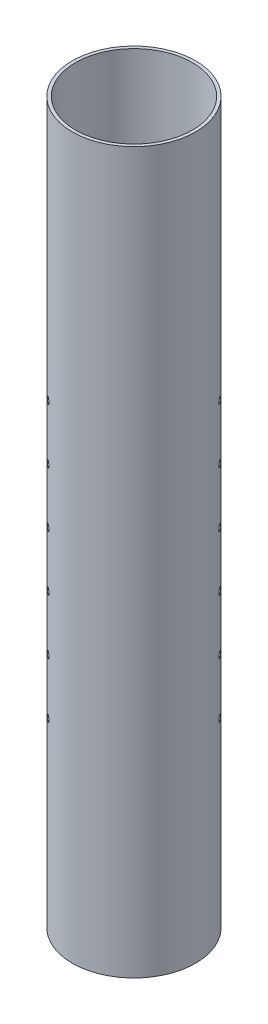
from build123d import *

# Parameters (mm, degrees)
SKETCH1_R                                     = 34.25
SKETCH1_R_2                                   = 32.5
BULK_DEPTH                                    = 400
SKETCH3_R                                     = 1.75
AVIONICS_FRONT_SCREW_HOLES_DEPTH              = 403.921983764
AVIONICS_LEFT_AND_RIGHT_SCREW_HOLES_COUNT     = 2
AVIONICS_LEFT_AND_RIGHT_SCREW_HOLES_ANGLE     = 100
AVIONICS_LEFT_AND_RIGHT_SCREW_HOLES_THE_COUNT = 2
AVIONICS_LEFT_AND_RIGHT_SCREW_HOLES_THE_ANGLE = 100
SKETCH4_W                                     = 40
SKETCH4_H                                     = 5
UMBILICAL_PASSTHRU_CUT_ANGLE                  = 20
UMBILICAL_PASSTHRU_CORNER_ROUNDING_R          = 3
RBF_CUTOUT_REACH                              = 410.251
RBF_CUTOUT_END_RADIUS                         = 32.5
SKETCH5_R                                     = 5


with BuildPart() as part:
    # Sketch1 → BULK (new body)
    with BuildSketch(Plane(origin=(0, 0, 0), x_dir=(1, 0, 0), z_dir=(0, 1, 0))):
        with Locations(Location((0, 0, 0), (0, 0, 270))):
            Circle(SKETCH1_R)
        with Locations(Location((0, 0, 0), (0, 0, 270))):
            Circle(SKETCH1_R_2, mode=Mode.SUBTRACT)
    extrude(amount=BULK_DEPTH)

    # Sketch3 → AVIONICS FRONT SCREW HOLES (cut, through all)
    with BuildSketch(Plane(origin=(0, 0, 0), x_dir=(-0.7071067811865477, 0, 0.7071067811865475), z_dir=(-0.7071067811865475, 0, -0.7071067811865477))):
        with Locations(Location((0, 105, 0), (0, 0, 180))):
            Circle(SKETCH3_R)
        with Locations(Location((0, 135.6, 0), (0, 0, 180))):
            Circle(SKETCH3_R)
        with Locations(Location((0, 166.2, 0), (0, 0, 180))):
            Circle(SKETCH3_R)
        with Locations(Location((0, 196.8, 0), (0, 0, 180))):
            Circle(SKETCH3_R)
        with Locations(Location((0, 227.4, 0), (0, 0, 180))):
            Circle(SKETCH3_R)
        with Locations(Location((0, 258, 0), (0, 0, 180))):
            Circle(SKETCH3_R)
    avionics_front_screw_holes = extrude(amount=AVIONICS_FRONT_SCREW_HOLES_DEPTH, mode=Mode.SUBTRACT)

    # AVIONICS LEFT AND RIGHT SCREW HOLES: AVIONICS FRONT SCREW HOLES ×2 about axis
    avionics_left_and_right_screw_holes_axis = Axis((0, 255, 0), (0, -1, 0))
    for i in range(1, AVIONICS_LEFT_AND_RIGHT_SCREW_HOLES_COUNT):
        add(avionics_front_screw_holes.rotate(avionics_left_and_right_screw_holes_axis, i * AVIONICS_LEFT_AND_RIGHT_SCREW_HOLES_ANGLE / (AVIONICS_LEFT_AND_RIGHT_SCREW_HOLES_COUNT - 1)), mode=Mode.SUBTRACT)

    # AVIONICS LEFT AND RIGHT SCREW HOLES the: AVIONICS FRONT SCREW HOLES ×2 about axis
    avionics_left_and_right_screw_holes_the_axis = Axis((0, 255, 0), (0, 1, 0))
    for i in range(1, AVIONICS_LEFT_AND_RIGHT_SCREW_HOLES_THE_COUNT):
        add(avionics_front_screw_holes.rotate(avionics_left_and_right_screw_holes_the_axis, i * AVIONICS_LEFT_AND_RIGHT_SCREW_HOLES_THE_ANGLE / (AVIONICS_LEFT_AND_RIGHT_SCREW_HOLES_THE_COUNT - 1)), mode=Mode.SUBTRACT)

    # Sketch4 → UMBILICAL PASSTHRU CUT (revolve, cut)
    with BuildSketch(Plane(origin=(0, 0, 0), x_dir=(0, -1, 0), z_dir=(0.608761429008719, 0, -0.7933533402912364))):
        with Locations((-158.98, 32.5)):
            Rectangle(SKETCH4_W, SKETCH4_H)
    revolve(axis=Axis((0, 255, 0), (0, 1, 0)), revolution_arc=UMBILICAL_PASSTHRU_CUT_ANGLE, mode=Mode.SUBTRACT)

    # UMBILICAL PASSTHRU CORNER ROUNDING
    umbilical_passthru_corner_rounding_edges = [part.edges().sort_by_distance(p)[0] for p in [
        (-31.830303231, 178.98, -10.036056058),
        (-31.830303231, 138.98, -10.036056058),
        (-26.478167732, 138.98, -20.317412693),
        (-26.478167732, 178.98, -20.317412693),
    ]]
    fillet(umbilical_passthru_corner_rounding_edges, radius=UMBILICAL_PASSTHRU_CORNER_ROUNDING_R)

    # RBF CUTOUT: up to this cylinder (the profile starts outside it)
    rbf_cutout_end = Plane(origin=(0, 165.3, 0), z_dir=(0, -1, 0)) * Cylinder(RBF_CUTOUT_END_RADIUS, 901.702, mode=Mode.PRIVATE)
    # Sketch5 → RBF CUTOUT (cut, up to the surface)
    with BuildSketch(Plane(origin=(-15.37454832, 0, -30.605322478), x_dir=(-0.8935860577428737, 0, 0.4488919217445883), z_dir=(-0.4488919217445883, 0, -0.8935860577428737)), mode=Mode.PRIVATE) as rbf_cutout_sk1:
        with Locations((0, 157.7)):
            Circle(SKETCH5_R)
    rbf_cutout_tool1 = extrude(rbf_cutout_sk1.sketch, amount=-RBF_CUTOUT_REACH, mode=Mode.PRIVATE) - rbf_cutout_end
    add(rbf_cutout_tool1.solids().sort_by_distance((-15.374548, 157.7, -30.605322))[0], mode=Mode.SUBTRACT)
    # Sketch5 → RBF CUTOUT (cut, up to the surface)
    with BuildSketch(Plane(origin=(-15.37454832, 0, -30.605322478), x_dir=(-0.8935860577428737, 0, 0.4488919217445883), z_dir=(-0.4488919217445883, 0, -0.8935860577428737)), mode=Mode.PRIVATE) as rbf_cutout_sk2:
        with Locations((0, 172.9)):
            Circle(SKETCH5_R)
    rbf_cutout_tool2 = extrude(rbf_cutout_sk2.sketch, amount=-RBF_CUTOUT_REACH, mode=Mode.PRIVATE) - rbf_cutout_end
    add(rbf_cutout_tool2.solids().sort_by_distance((-15.374548, 172.9, -30.605322))[0], mode=Mode.SUBTRACT)


solid = part.part
